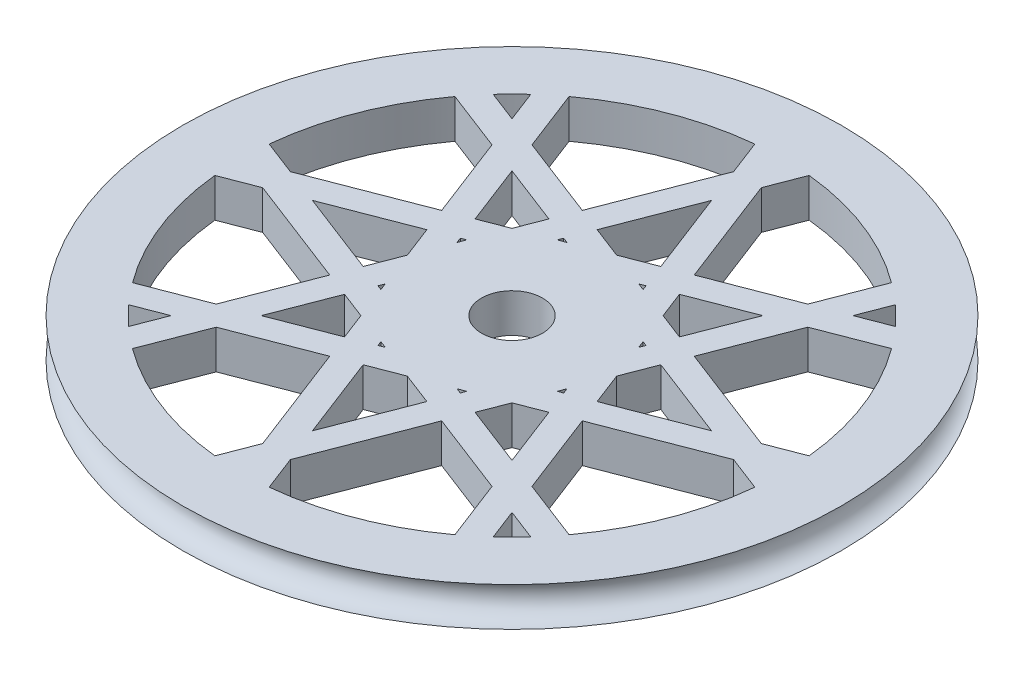
from build123d import *

# Parameters (mm, degrees)
SKETCH2_R           = 8
SKETCH2_R_2         = 2.5
BOSS_EXTRUDE1_DEPTH = 3.175
BOSS_EXTRUDE2_START = -3.175
BOSS_EXTRUDE2_DEPTH = 3.175


with BuildPart() as part:
    # Sketch1 → Revolve2 (revolve)
    with BuildSketch(Plane.XY, mode=Mode.PRIVATE) as revolve2_sk:
        with BuildLine():
            Line((0, 0), (0, 3.175))
            Line((0, 3.175), (3.175, 3.175))
            Line((3.175, 3.175), (4.7625, 3.175))
            ThreePointArc((4.7625, 3.175), (3.175, 1.5875), (4.7625, 0))
            Line((4.7625, 0), (3.175, 0))
            Line((3.175, 0), (0, 0))
        make_face()
    revolve(revolve2_sk.sketch.rotate(Axis((-22.225, 12.769143385, 0), (0, -1, 0)), 180), axis=Axis((-22.225, 12.769143385, 0), (0, -1, 0)))



with BuildPart() as body_2:
    # Sketch2 → Boss-Extrude1 (new body)
    with BuildSketch(Plane(origin=(0, 0, 0), x_dir=(1, 0, 0), z_dir=(0, 1, 0))):
        with Locations(Location((-22.225, 0, 0), (0, 0, 180))):
            Circle(SKETCH2_R)
        with Locations(Location((-22.225, 0, 0), (0, 0, 180))):
            Circle(SKETCH2_R_2, mode=Mode.SUBTRACT)
    extrude(amount=BOSS_EXTRUDE1_DEPTH)


with BuildPart() as part_1:
    add(part.part)

    add(body_2.part)  # Boss-Extrude2 merges body 2
    # Sketch4 → Boss-Extrude2 (add)
    with BuildSketch(Plane.XZ.offset(BOSS_EXTRUDE2_START)):
        with BuildLine():
            Line((-22.224995499, -16.344642731), (-35.42857082, 17.877817054))
            ThreePointArc((-35.42857082, 17.877817054), (-36.308247437, 17.19339311), (-37.152505221, 16.465728434))
            Line((-37.152505221, 16.465728434), (-23.359368534, -19.284820497))
            Line((-23.359368534, -19.284820497), (-24.450638712, -22.113280112))
            ThreePointArc((-24.450638712, -22.113280112), (-22.225000553, -22.225), (-19.999362388, -22.113280223))
            Line((-19.999362388, -22.113280223), (-21.090626965, -19.284822234))
            Line((-21.090626965, -19.284822234), (-7.297444367, 16.465682732))
            ThreePointArc((-7.297444367, 16.465682732), (-8.141700351, 17.193350342), (-9.021375334, 17.877777286))
            Line((-9.021375334, 17.877777286), (-22.224995499, -16.344642731))
        make_face()
        with BuildLine():
            Line((-41.509820497, 1.134368534), (-5.759271566, 14.927505221))
            ThreePointArc((-5.759271566, 14.927505221), (-5.03160689, 14.083247437), (-4.347182946, 13.20357082))
            Line((-4.347182946, 13.20357082), (-38.569642731, -4.501e-06))
            Line((-38.569642731, -4.501e-06), (-4.347222714, -13.203624666))
            ThreePointArc((-4.347222714, -13.203624666), (-5.031649658, -14.083299649), (-5.759317268, -14.927555633))
            Line((-5.759317268, -14.927555633), (-41.509822234, -1.134373035))
            Line((-41.509822234, -1.134373035), (-44.338280223, -2.225637612))
            ThreePointArc((-44.338280223, -2.225637612), (-44.45, 5.53e-07), (-44.338280112, 2.225638712))
            Line((-44.338280112, 2.225638712), (-41.509820497, 1.134368534))
        make_face()
        with BuildLine():
            Line((-21.090631466, 19.284820497), (-7.297494779, -16.465728434))
            ThreePointArc((-7.297494779, -16.465728434), (-8.141752563, -17.19339311), (-9.02142918, -17.877817054))
            Line((-9.02142918, -17.877817054), (-22.225004501, 16.344642731))
            Line((-22.225004501, 16.344642731), (-35.428624666, -17.877777286))
            ThreePointArc((-35.428624666, -17.877777286), (-36.308299649, -17.193350342), (-37.152555633, -16.465682732))
            Line((-37.152555633, -16.465682732), (-23.359373035, 19.284822234))
            Line((-23.359373035, 19.284822234), (-24.450637612, 22.113280223))
            ThreePointArc((-24.450637612, 22.113280223), (-22.224999447, 22.225), (-19.999361288, 22.113280112))
            Line((-19.999361288, 22.113280112), (-21.090631466, 19.284820497))
        make_face()
        with BuildLine():
            Line((-2.940179503, -1.134368534), (-38.690728434, -14.927505221))
            ThreePointArc((-38.690728434, -14.927505221), (-39.41839311, -14.083247437), (-40.102817054, -13.20357082))
            Line((-40.102817054, -13.20357082), (-5.880357269, 4.501e-06))
            Line((-5.880357269, 4.501e-06), (-40.102777286, 13.203624666))
            ThreePointArc((-40.102777286, 13.203624666), (-39.418350342, 14.083299649), (-38.690682732, 14.927555633))
            Line((-38.690682732, 14.927555633), (-2.940177766, 1.134373035))
            Line((-2.940177766, 1.134373035), (-0.111719777, 2.225637612))
            ThreePointArc((-0.111719777, 2.225637612), (0, -5.53e-07), (-0.111719888, -2.225638712))
            Line((-0.111719888, -2.225638712), (-2.940179503, -1.134368534))
        make_face()
    extrude(amount=BOSS_EXTRUDE2_DEPTH)


solid = part_1.part
